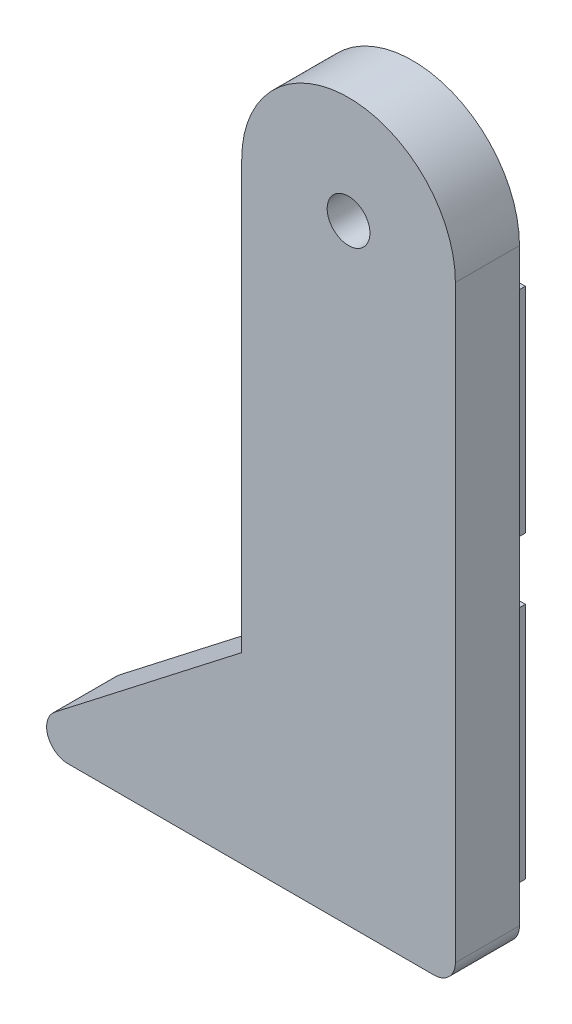
from build123d import *

# Parameters (mm, degrees)
SKETCH_1_R      = 1
EXTRUDE_1_DEPTH = 3
EXTRUDE_2_DEPTH = 3
FILLET_2_R      = 1
FILLET_3_R      = 1
EXTRUDE_4_DEPTH = 1


with BuildPart() as part:
    # 草图1 → 凸台-拉伸1 (new body)
    with BuildSketch(Plane.XY):
        with BuildLine():
            Line((-5, 0), (-5, -20))
            Line((-5, -20), (5, -20))
            Line((5, -20), (5, 0))
            ThreePointArc((5, 0), (0, 5), (-5, 0))
        make_face()
        Circle(SKETCH_1_R, mode=Mode.SUBTRACT)
    extrude(amount=EXTRUDE_1_DEPTH)

    # 草图2 → 凸台-拉伸2 (add)
    with BuildSketch(Plane.XY.offset(3)):
        Polygon((5, -20), (-5, -20), (-16.053330201, -28.571505672), (5, -28.571505672), align=None)
    extrude(amount=-EXTRUDE_2_DEPTH)

    # 圆角2
    fillet_2_edges = [part.edges().sort_by_distance(p)[0] for p in [
        (-16.053330201, -28.571505672, 1.5),
    ]]
    fillet(fillet_2_edges, radius=FILLET_2_R)

    # 圆角3
    fillet_3_edges = [part.edges().sort_by_distance(p)[0] for p in [
        (5, -28.571505672, 1.5),
    ]]
    fillet(fillet_3_edges, radius=FILLET_3_R)

    # 草图4 → 凸台-拉伸4 (add)
    with BuildSketch(Plane(origin=(0, 0, 0), x_dir=(-1, 0, 0), z_dir=(0, 0, -1))):
        Polygon((-4.275312121, -2.510402489), (-4.275312121, -12.516814932), (-2.995953453, -12.516814932), (-2.995953453, -8.633047546), (1.938715697, -12.516814932), (4.31466751, -12.516814932), (-2.995953453, -6.763085471), (4.31466751, -2.510402489), (1.207653601, -2.510402489), (-2.995953453, -4.955695204), (-2.995953453, -2.510402489), align=None)
        Polygon((-4.275312121, -15.401899276), (-4.275312121, -26.544068904), (-2.995953453, -26.544068904), (-2.995953453, -22.614610137), (1.938715697, -26.544068904), (4.31466751, -26.544068904), (-2.995953453, -20.722648508), (4.31466751, -15.401899276), (1.207653601, -15.401899276), (-2.995953453, -18.461330084), (-2.995953453, -15.401899276), align=None)
    extrude(amount=EXTRUDE_4_DEPTH)


solid = part.part
